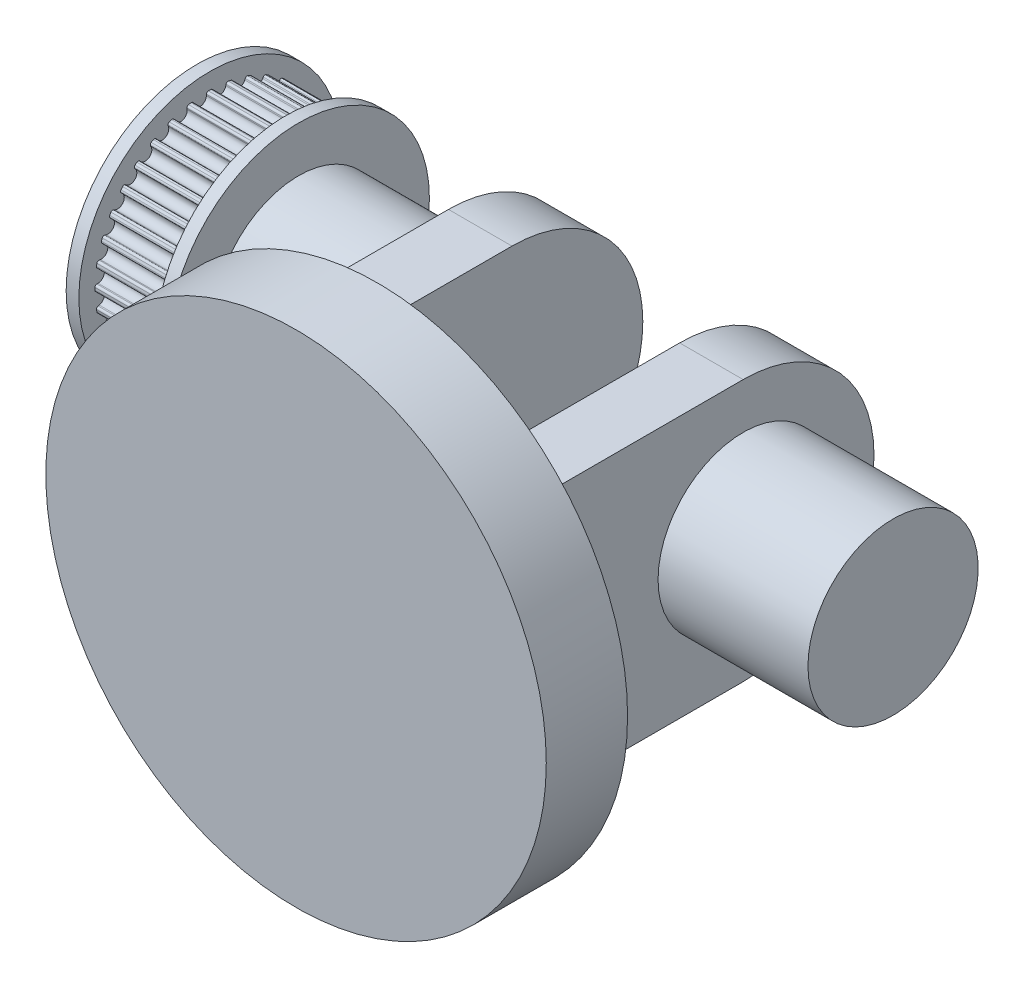
from build123d import *

# Parameters (mm, degrees)
EXTRUDE1_DEPTH    = 32
EXTRUDE2_DEPTH    = 25
SKETCH4_R         = 33.5
EXTRUDE3_DEPTH    = 59
SKETCH5_R         = 51.5
EXTRUDE4_DEPTH    = 5
SKETCH7_R         = 45.15
EXTRUDE5_DEPTH    = 30
EXTRUDE7_DEPTH    = 30
CIRPATTERN1_COUNT = 36
SKETCH8_R         = 51.5
EXTRUDE8_DEPTH    = 5
EXTRUDE9_START    = -32
EXTRUDE9_DEPTH    = 32


with BuildPart() as part:
    # Sketch2 → Extrude1 (new body)
    with BuildSketch(Plane.XY):
        with BuildLine():
            Line((-58, -79.613127058), (-58, 79.613127058))
            ThreePointArc((-58, 79.613127058), (0, 98.5), (58, 79.613127058))
            Line((58, 79.613127058), (58, -79.613127058))
            ThreePointArc((58, -79.613127058), (0, -98.5), (-58, -79.613127058))
        make_face()
    extrude(amount=EXTRUDE1_DEPTH)

    # Sketch3 → Extrude2 (add)
    with BuildSketch(Plane.ZY.offset(58)):
        with BuildLine():
            Line((-86, 51.5), (0, 51.5))
            Line((0, 51.5), (0, -51.5))
            Line((0, -51.5), (-86, -51.5))
            ThreePointArc((-86, -51.5), (-137.5, 0), (-86, 51.5))
        make_face()
    extrude2 = extrude(amount=-EXTRUDE2_DEPTH)

    # Sketch4 → Extrude3 (add)
    with BuildSketch(Plane.ZY.offset(58)):
        with Locations(Location((-86, 0, 0), (0, 0, 180))):
            Circle(SKETCH4_R)
    extrude3 = extrude(amount=EXTRUDE3_DEPTH)

    # Mirror1: Extrude2, Extrude3 across plane
    add(extrude2.mirror(Plane(origin=(0, 0, 0), x_dir=(0, 0, 1), z_dir=(1, 0, 0))))
    add(extrude3.mirror(Plane(origin=(0, 0, 0), x_dir=(0, 0, 1), z_dir=(1, 0, 0))))

    # Sketch5 → Extrude4 (add)
    with BuildSketch(Plane(origin=(-117, 0, 0), x_dir=(0, 0, -1), z_dir=(1, 0, 0))):
        with Locations((86, 0)):
            Circle(SKETCH5_R)
    extrude(amount=-EXTRUDE4_DEPTH)

    # Sketch7 → Extrude5 (add)
    with BuildSketch(Plane.ZY.offset(122)):
        with Locations((-86, 0)):
            Circle(SKETCH7_R)
    extrude(amount=EXTRUDE5_DEPTH)

    # Sketch6 → Extrude7 (cut)
    with BuildSketch(Plane.ZY.offset(122)):
        with BuildLine():
            Line((-87.265610805, 44.394558923), (-87.282106289, 43.922190055))
            ThreePointArc((-87.282106289, 43.922190055), (-89.626550456, 41.451661388), (-92.364380048, 43.477548716))
            Line((-92.364380048, 43.477548716), (-92.462650922, 43.939876828))
            ThreePointArc((-92.462650922, 43.939876828), (-92.785899963, 44.421956093), (-93.352628199, 44.547293504))
            ThreePointArc((-93.352628199, 44.547293504), (-89.935081785, 44.978190619), (-86.494631081, 45.147290507))
            ThreePointArc((-86.494631081, 45.147290507), (-87.030984829, 44.925445927), (-87.265610805, 44.394558923))
        make_face()
    extrude7 = extrude(amount=EXTRUDE7_DEPTH, mode=Mode.SUBTRACT)

    # CirPattern1: Extrude7 ×36 about axis
    cirpattern1_axis = Axis((0, 0, -86), (1, 0, 0))
    for i in range(1, CIRPATTERN1_COUNT):
        add(extrude7.rotate(cirpattern1_axis, i * 360 / CIRPATTERN1_COUNT), mode=Mode.SUBTRACT)

    # Sketch8 → Extrude8 (add)
    with BuildSketch(Plane.ZY.offset(152)):
        with Locations(Location((-86, 0, 0), (0, 0, 180))):
            Circle(SKETCH8_R)
    extrude(amount=EXTRUDE8_DEPTH)

    # Sketch9 → Extrude9 (add)
    with BuildSketch(Plane.XY.offset(32).offset(EXTRUDE9_START)):
        with BuildLine():
            Line((-58, 79.613127058), (-58, -79.613127058))
            ThreePointArc((-58, -79.613127058), (-98.5, 0), (-58, 79.613127058))
        make_face()
        with BuildLine():
            Line((58, 79.613127058), (58, -79.613127058))
            ThreePointArc((58, -79.613127058), (98.5, 0), (58, 79.613127058))
        make_face()
    extrude(amount=EXTRUDE9_DEPTH)


solid = part.part
